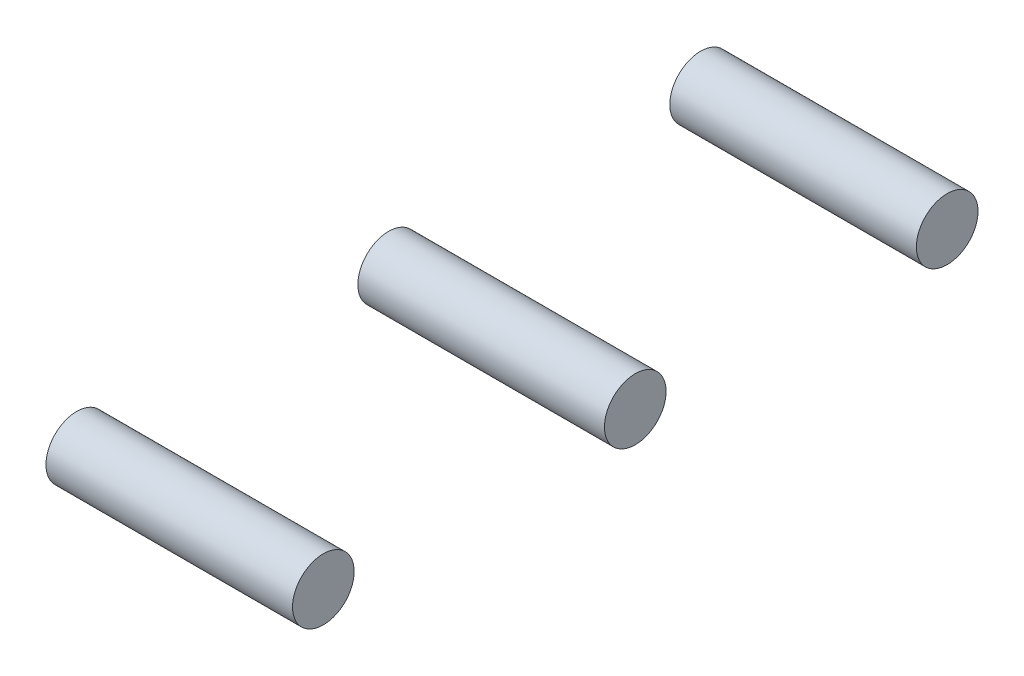
from build123d import *

# Parameters (mm, degrees)
SKETCH1_R             = 2.5
BOSS_EXTRUDE1_DEPTH   = 20
BOSS_EXTRUDE1_2_DEPTH = 20
BOSS_EXTRUDE1_3_DEPTH = 20


with BuildPart() as part:
    # Sketch1 → Boss-Extrude1 (new body)
    with BuildSketch(Plane(origin=(0, 0, 0), x_dir=(0, 0, -1), z_dir=(1, 0, 0))):
        Circle(SKETCH1_R)
    extrude(amount=BOSS_EXTRUDE1_DEPTH)


with BuildPart() as body_2:
    # Sketch1 → Boss-Extrude1 2 (new body)
    with BuildSketch(Plane(origin=(0, 0, 0), x_dir=(0, 0, -1), z_dir=(1, 0, 0))):
        with Locations((-25.3, 0)):
            Circle(SKETCH1_R)
    extrude(amount=BOSS_EXTRUDE1_2_DEPTH)


with BuildPart() as body_3:
    # Sketch1 → Boss-Extrude1 3 (new body)
    with BuildSketch(Plane(origin=(0, 0, 0), x_dir=(0, 0, -1), z_dir=(1, 0, 0))):
        with Locations((25.3, 0)):
            Circle(SKETCH1_R)
    extrude(amount=BOSS_EXTRUDE1_3_DEPTH)


solid = Compound([part.part, body_2.part, body_3.part])
